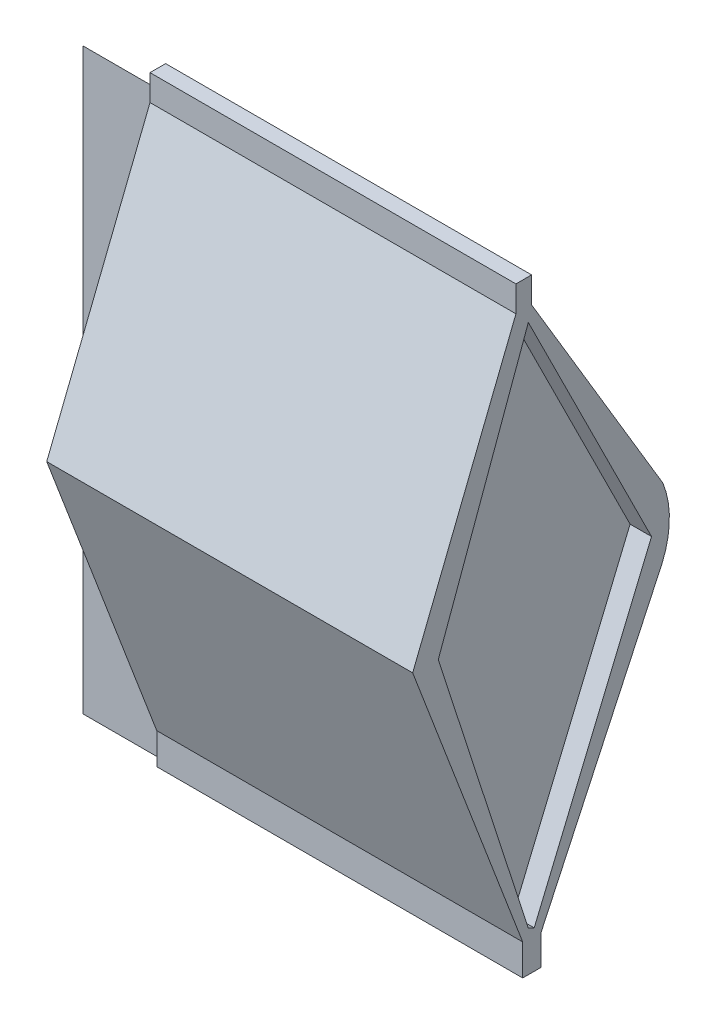
from build123d import *

# Parameters (mm, degrees)
SKETCH4_W           = 62.83623107
SKETCH4_H           = 84.722256574
BOSS_EXTRUDE2_DEPTH = 50
CUT_EXTRUDE2_DEPTH  = 80
CUT_EXTRUDE3_DEPTH  = 80
CUT_EXTRUDE5_DEPTH  = 80
CUT_EXTRUDE6_DEPTH  = 3
CUT_EXTRUDE8_DEPTH  = 80


with BuildPart() as part:
    # Sketch4 → Boss-Extrude2 (new body)
    with BuildSketch(Plane.XY):
        Rectangle(SKETCH4_W, SKETCH4_H)
    extrude(amount=BOSS_EXTRUDE2_DEPTH)

    # Sketch5 → Cut-Extrude2 (cut)
    with BuildSketch(Plane(origin=(31.418115535, 0, 0), x_dir=(0, 0, -1), z_dir=(1, 0, 0))):
        Polygon((-31.846034257, 38.728174008), (-31.846034257, 42.361128287), (-50, 42.361128287), (-50, -42.361128287), (-30.898434646, -42.361128287), (-30.898434646, -37.982426726), (-46.322270236, 2.38891709), align=None)
    extrude(amount=-CUT_EXTRUDE2_DEPTH, mode=Mode.SUBTRACT)

    # Sketch6 → Cut-Extrude3 (cut)
    with BuildSketch(Plane(origin=(31.418115535, 0, 0), x_dir=(0, 0, -1), z_dir=(1, 0, 0))):
        Polygon((-29.655383969, 42.361128287), (-29.655383969, 38.722554473), (-8.776416022, 3.750158878), (-28.328453067, -38.117745), (-28.328453067, -42.361128287), (-27.677514405, -46.625913761), (16.839811583, -52.045359618), (10.267667228, 27.190343951), (3.73953172, 54.484047391), align=None)
    extrude(amount=-CUT_EXTRUDE3_DEPTH, mode=Mode.SUBTRACT)

    # Sketch7 → Cut-Extrude5 (cut)
    with BuildSketch(Plane.ZY.offset(31.418115535)):
        with BuildLine():
            ThreePointArc((13.228873585, 11.208051798), (10.417703783, 4.563945687), (11.71087014, -2.533556863))
            ThreePointArc((11.71087014, -2.533556863), (0.747619784, 5.632177302), (13.228873585, 11.208051798))
        make_face()
    extrude(amount=-CUT_EXTRUDE5_DEPTH, mode=Mode.SUBTRACT)

    # Sketch8 → Cut-Extrude6 (cut)
    with BuildSketch(Plane(origin=(31.418115535, 0, 0), x_dir=(0, 0, -1), z_dir=(1, 0, 0))):
        Polygon((-30.111598921, 36.817435747), (-42.735074125, 2.19595341), (-30.111598921, -36.694083179), (-29.289064541, -37.07820135), (-12.845557678, 2.19595341), align=None)
    extrude(amount=-CUT_EXTRUDE6_DEPTH, mode=Mode.SUBTRACT)

    # Sketch9 → Cut-Extrude8 (cut)
    with BuildSketch(Plane(origin=(0, 0, 29.655383969), x_dir=(-1, 0, 0), z_dir=(0, 0, -1))):
        Polygon((19.869908303, 42.361128287), (19.869908303, 38.722554473), (19.869908303, 5.586987563), (19.869908303, -4.186945454), (19.869908303, -38.208459621), (19.869908303, -42.059759196), (19.869908303, -47.026854784), (41.256673117, -49.585938288), (42.081255469, -21.197702537), (42.081255469, 12.428184914), (37.482224788, 37.513066745), (31.418115535, 49.4837873), align=None)
    extrude(amount=-CUT_EXTRUDE8_DEPTH, mode=Mode.SUBTRACT)


solid = part.part
